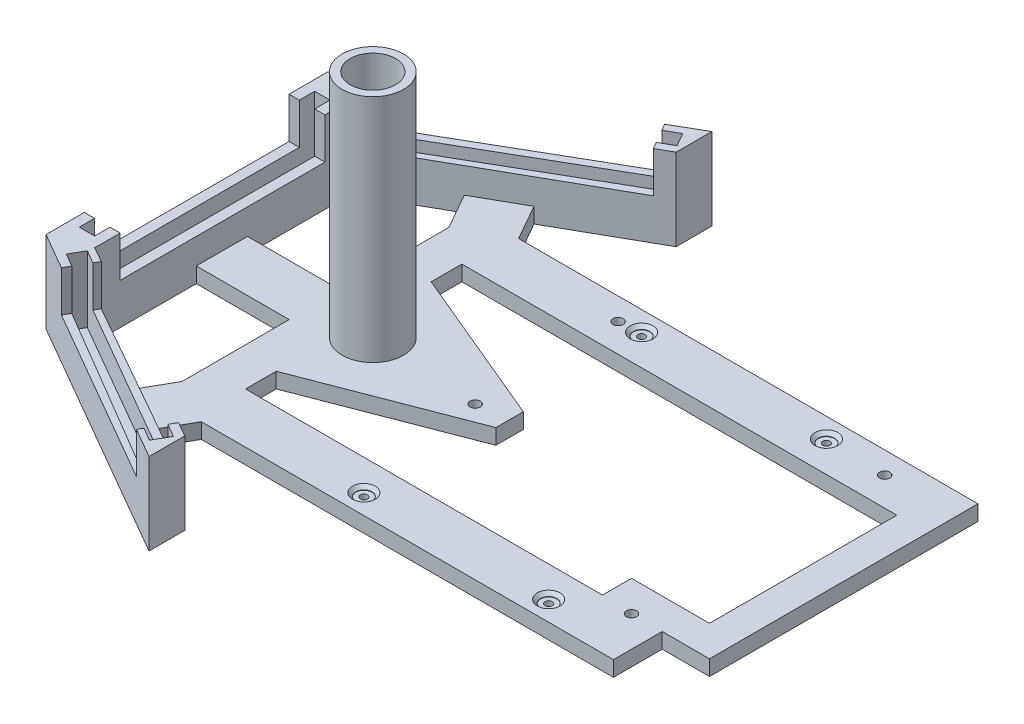
from build123d import *

# Parameters (mm, degrees)
BOSS_EXTRUDE1_DEPTH                         = 3
BOSS_EXTRUDE7_DEPTH                         = 13
SKETCH14_W                                  = 3
SKETCH14_H                                  = 46
CUT_EXTRUDE1_DEPTH                          = 13
SKETCH15_W                                  = 7
SKETCH15_H                                  = 40
CUT_EXTRUDE3_DEPTH                          = 8
CUT_EXTRUDE5_REACH                          = 97.01
SKETCH18_R                                  = 6
SKETCH18_R_2                                = 4.445
BOSS_EXTRUDE8_DEPTH                         = 45
CBORE_FOR_00_BINDING_HEAD_MACHINE_S_2_COUNT = 2
CBORE_FOR_00_BINDING_HEAD_MACHINE_S_2_PITCH = 54.28
CBORE_FOR_00_BINDING_HEAD_MACHINE_S_3_COUNT = 2
CBORE_FOR_00_BINDING_HEAD_MACHINE_S_3_PITCH = 65.199484661
CBORE_FOR_00_BINDING_HEAD_MACHINE_S_4_COUNT = 2
CBORE_FOR_00_BINDING_HEAD_MACHINE_S_4_PITCH = 36.12
SKETCH22_R                                  = 1
CUT_EXTRUDE6_DEPTH                          = 105.321261807
CUT_EXTRUDE8_DEPTH                          = 105.321261807
SKETCH24_W                                  = 9.24
SKETCH24_H                                  = 9.529738598
CUT_EXTRUDE9_DEPTH                          = 105.321261807


with BuildPart() as part:
    # Sketch1 → Boss-Extrude1 (new body)
    with BuildSketch(Plane(origin=(0, 0, 0), x_dir=(1, 0, 0), z_dir=(0, 1, 0))):
        Polygon((-76.37359272, 27.5), (-76.37359272, -27.5), (-28.742195512, -55), (-28.742195512, -31), (47.257804488, -31), (47.257804488, 31), (-28.742195512, 31), (-28.742195512, 55), align=None)
    extrude(amount=BOSS_EXTRUDE1_DEPTH)

    # Sketch11 → Boss-Extrude7 (add)
    with BuildSketch(Plane(origin=(0, 3, 0), x_dir=(1, 0, 0), z_dir=(0, 1, 0))):
        Polygon((-28.742195512, -55), (-28.742195512, -48), (-69.37359272, -24.979495292), (-69.37359272, 24.979495292), (-28.742195512, 48), (-28.742195512, 55), (-76.37359272, 27.5), (-76.37359272, -27.5), align=None)
    extrude(amount=BOSS_EXTRUDE7_DEPTH)

    # Sketch14 → Cut-Extrude1 (cut)
    with BuildSketch(Plane(origin=(0, 16, 0), x_dir=(1, 0, 0), z_dir=(0, 1, 0))):
        Polygon((-29.742195512, 49.210281508), (-69.579364086, 26.210281508), (-71.079364086, 28.80835772), (-31.242195512, 51.80835772), align=None)
        with Locations((-72.87359272, 0)):
            Rectangle(SKETCH14_W, SKETCH14_H)
        Polygon((-71.079364086, -28.80835772), (-31.476965636, -52.210281508), (-29.742195512, -49.210281508), (-69.579364086, -26.210281508), align=None)
    extrude(amount=-CUT_EXTRUDE1_DEPTH, mode=Mode.SUBTRACT)

    # Sketch15 → Cut-Extrude3 (cut)
    with BuildSketch(Plane(origin=(0, 16, 0), x_dir=(1, 0, 0), z_dir=(0, 1, 0))):
        with Locations((-72.87359272, 0)):
            Rectangle(SKETCH15_W, SKETCH15_H)
        Polygon((-69.238309522, 31.619557675), (-66.423300051, 26.651040721), (-31.579449527, 46.392498809), (-34.59729337, 51.619557675), align=None)
        Polygon((-66.396023158, -26.666494973), (-69.251333812, -31.612038098), (-34.568999008, -51.635893433), (-31.593683239, -46.384434424), align=None)
    extrude(amount=-CUT_EXTRUDE3_DEPTH, mode=Mode.SUBTRACT)

    # Sketch17 → Cut-Extrude5 (cut, up to next)
    with BuildSketch(Plane(origin=(0, 3, 0), x_dir=(1, 0, 0), z_dir=(0, 1, 0)), mode=Mode.PRIVATE) as cut_extrude5_sk1:
        Polygon((-69.37359272, -24.979495292), (-69.37359272, -5.130907192), (-51.219056623, -5.130907192), (-51.219056623, -26.070515137), (-55.162644513, -33.030983121), align=None)
    cut_extrude5_tool1 = extrude(cut_extrude5_sk1.sketch, amount=-CUT_EXTRUDE5_REACH, mode=Mode.PRIVATE) & part.part
    # Sketch17 → Cut-Extrude5 (cut, up to next)
    with BuildSketch(Plane(origin=(0, 3, 0), x_dir=(1, 0, 0), z_dir=(0, 1, 0)), mode=Mode.PRIVATE) as cut_extrude5_sk2:
        Polygon((-69.37359272, 24.979495292), (-69.37359272, 4.869092808), (-51.219056623, 4.869092808), (-51.219056623, 26.070515137), (-55.162644513, 33.030983121), align=None)
    cut_extrude5_tool2 = extrude(cut_extrude5_sk2.sketch, amount=-CUT_EXTRUDE5_REACH, mode=Mode.PRIVATE) & part.part
    # Sketch17 → Cut-Extrude5 (cut, up to next)
    with BuildSketch(Plane(origin=(0, 3, 0), x_dir=(1, 0, 0), z_dir=(0, 1, 0)), mode=Mode.PRIVATE) as cut_extrude5_sk3:
        Polygon((-28.742195512, -48), (-46.462059534, -37.960467984), (-42.518471644, -31), (-28.742195512, -31), align=None)
    cut_extrude5_tool3 = extrude(cut_extrude5_sk3.sketch, amount=-CUT_EXTRUDE5_REACH, mode=Mode.PRIVATE) & part.part
    # Sketch17 → Cut-Extrude5 (cut, up to next)
    with BuildSketch(Plane(origin=(0, 3, 0), x_dir=(1, 0, 0), z_dir=(0, 1, 0)), mode=Mode.PRIVATE) as cut_extrude5_sk4:
        Polygon((-28.742195512, 31), (-42.518471644, 31), (-46.462059534, 37.960467984), (-28.742195512, 48), align=None)
    cut_extrude5_tool4 = extrude(cut_extrude5_sk4.sketch, amount=-CUT_EXTRUDE5_REACH, mode=Mode.PRIVATE) & part.part
    add(cut_extrude5_tool1.solids().sort_by_distance((-59.97086, 3, 17.234777))[0], mode=Mode.SUBTRACT)
    add(cut_extrude5_tool2.solids().sort_by_distance((-59.974373, 3, -17.10271))[0], mode=Mode.SUBTRACT)
    add(cut_extrude5_tool3.solids().sort_by_distance((-35.757612, 3, 37.618563))[0], mode=Mode.SUBTRACT)
    add(cut_extrude5_tool4.solids().sort_by_distance((-35.757612, 3, -37.618563))[0], mode=Mode.SUBTRACT)

    # Sketch18 → Boss-Extrude8 (add)
    with BuildSketch(Plane(origin=(0, 3, 0), x_dir=(1, 0, 0), z_dir=(0, 1, 0))):
        with Locations(Location((-40, 0, 0), (0, 0, 90))):
            Circle(SKETCH18_R)
        with Locations(Location((-40, 0, 0), (0, 0, 90))):
            Circle(SKETCH18_R_2, mode=Mode.SUBTRACT)
    extrude(amount=BOSS_EXTRUDE8_DEPTH)

    # Sketch21 → CBORE for #00 Binding Head Machine Screw1 (revolve, cut)
    with BuildSketch(Plane(origin=(-14.622195512, 3, 27.14), x_dir=(0, 0, 1), z_dir=(1, 0, 0))):
        Polygon((0, 0), (0, 3), (0.6985, 3), (0.6985, 0.7112), (1.5875, 0.7112), (1.5875, 0.635), (2.2225, 0), align=None)
    cbore_for_00_binding_head_machine_screw = revolve(axis=Axis((-14.622195512, 9.35, 27.14), (0, -1, 0)), mode=Mode.SUBTRACT)

    # CBORE for _00 Binding Head Machine S 2: CBORE for #00 Binding Head Machine Screw1 ×2
    with Locations(*[(0, 0, -i * CBORE_FOR_00_BINDING_HEAD_MACHINE_S_2_PITCH) for i in range(1, CBORE_FOR_00_BINDING_HEAD_MACHINE_S_2_COUNT)]):
        add(cbore_for_00_binding_head_machine_screw, mode=Mode.SUBTRACT)

    # CBORE for _00 Binding Head Machine S 3: CBORE for #00 Binding Head Machine Screw1 ×2
    with Locations(*[Vector(0.5539921088035915, 0, -0.832521917659439) * (i * CBORE_FOR_00_BINDING_HEAD_MACHINE_S_3_PITCH) for i in range(1, CBORE_FOR_00_BINDING_HEAD_MACHINE_S_3_COUNT)]):
        add(cbore_for_00_binding_head_machine_screw, mode=Mode.SUBTRACT)

    # CBORE for _00 Binding Head Machine S 4: CBORE for #00 Binding Head Machine Screw1 ×2
    with Locations(*[(i * CBORE_FOR_00_BINDING_HEAD_MACHINE_S_4_PITCH, 0, 0) for i in range(1, CBORE_FOR_00_BINDING_HEAD_MACHINE_S_4_COUNT)]):
        add(cbore_for_00_binding_head_machine_screw, mode=Mode.SUBTRACT)

    # Sketch22 → Cut-Extrude6 (cut, through all)
    with BuildSketch(Plane(origin=(0, 3, 0), x_dir=(1, 0, 0), z_dir=(0, 1, 0))):
        with Locations(Location((33.287804488, 26.734999831, 0), (0, 0, 270))):
            Circle(SKETCH22_R)
        with Locations(Location((32.017804488, -21.470261402, 0), (0, 0, 270))):
            Circle(SKETCH22_R)
        with Locations(Location((-18.742195512, 26.67, 0), (0, 0, 270))):
            Circle(SKETCH22_R)
        with Locations(Location((-18.742195512, -1.26, 0), (0, 0, 270))):
            Circle(SKETCH22_R)
    extrude(amount=-CUT_EXTRUDE6_DEPTH, mode=Mode.SUBTRACT)

    # Sketch23 → Cut-Extrude8 (cut, through all)
    with BuildSketch(Plane(origin=(0, 3, 0), x_dir=(1, 0, 0), z_dir=(0, 1, 0))):
        Polygon((-43.742195512, 21.14), (-43.742195512, 15.14), (-12.742195512, 2.140015237), (-12.742195512, -3.206984729), (-43.742195512, -15.14), (-43.742195512, -21.14), (26.017804488, -21.14), (26.017804488, -15.470261402), (41.257804488, -15.470261402), (41.257804488, 21.14), align=None)
    extrude(amount=-CUT_EXTRUDE8_DEPTH, mode=Mode.SUBTRACT)

    # Sketch24 → Cut-Extrude9 (cut, through all)
    with BuildSketch(Plane(origin=(0, 3, 0), x_dir=(1, 0, 0), z_dir=(0, 1, 0))):
        with Locations((42.637804488, -26.235130701)):
            Rectangle(SKETCH24_W, SKETCH24_H)
    extrude(amount=-CUT_EXTRUDE9_DEPTH, mode=Mode.SUBTRACT)


solid = part.part
